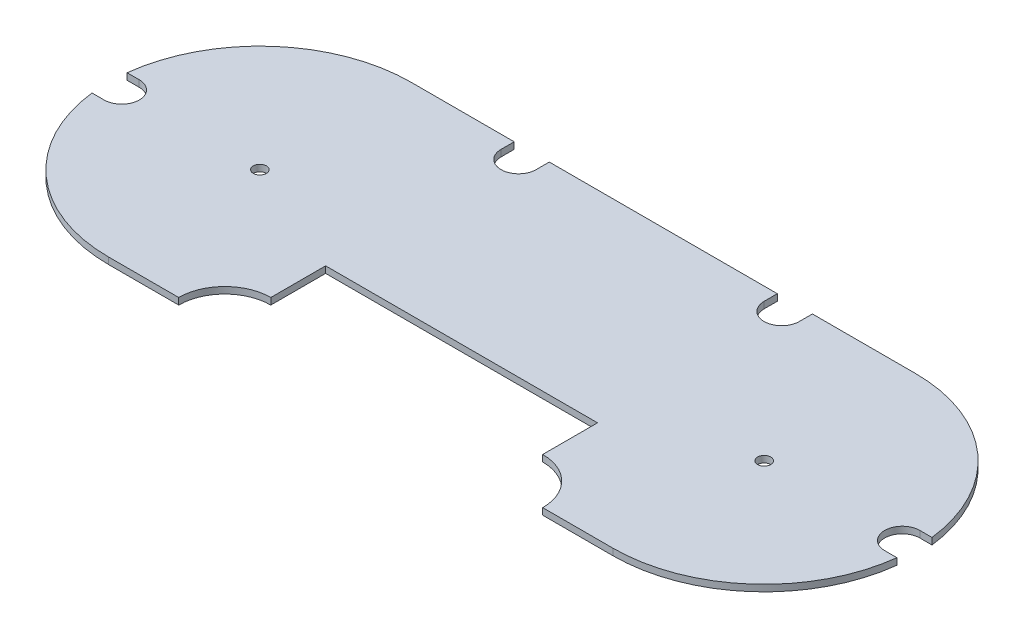
from build123d import *

# Parameters (mm, degrees)
SKETCH1_R   = 1.5
BOARD_DEPTH = 1.5


with BuildPart() as part:
    # Sketch1 → board (new body)
    with BuildSketch(Plane(origin=(0, 0, 0), x_dir=(1, 0, 0), z_dir=(0, 1, 0))):
        with BuildLine():
            Line((0, 34.5), (-26, 34.5))
            Line((-26, 34.5), (-26, 31.5))
            ThreePointArc((-26, 31.5), (-30, 27.5), (-34, 31.5))
            Line((-34, 31.5), (-34, 34.5))
            Line((-34, 34.5), (-57.5, 34.5))
            ThreePointArc((-57.5, 34.5), (-80.43741485, 25.77062281), (-91.767331381, 4))
            Line((-91.767331381, 4), (-89, 4))
            ThreePointArc((-89, 4), (-85, 0), (-89, -4))
            Line((-89, -4), (-91.767331381, -4))
            ThreePointArc((-91.767331381, -4), (-80.43741485, -25.77062281), (-57.5, -34.5))
            Line((-57.5, -34.5), (-41.5, -34.5))
            ThreePointArc((-41.5, -34.5), (-38.424621202, -27.075378798), (-31, -24))
            Line((-31, -24), (-31, -11.5))
            Line((-31, -11.5), (31, -11.5))
            Line((31, -11.5), (31, -24))
            ThreePointArc((31, -24), (38.424621202, -27.075378798), (41.5, -34.5))
            Line((41.5, -34.5), (57.5, -34.5))
            ThreePointArc((57.5, -34.5), (80.43741485, -25.77062281), (91.767331381, -4))
            Line((91.767331381, -4), (89, -4))
            ThreePointArc((89, -4), (85, 0), (89, 4))
            Line((89, 4), (91.767331381, 4))
            ThreePointArc((91.767331381, 4), (80.43741485, 25.77062281), (57.5, 34.5))
            Line((57.5, 34.5), (34, 34.5))
            Line((34, 34.5), (34, 31.5))
            ThreePointArc((34, 31.5), (30, 27.5), (26, 31.5))
            Line((26, 31.5), (26, 34.5))
            Line((26, 34.5), (0, 34.5))
        make_face()
        with Locations(Location((-57.5, 0, 0), (0, 0, 270))):
            Circle(SKETCH1_R, mode=Mode.SUBTRACT)
        with Locations(Location((57.5, 0, 0), (0, 0, 270))):
            Circle(SKETCH1_R, mode=Mode.SUBTRACT)
    extrude(amount=BOARD_DEPTH)


solid = part.part
